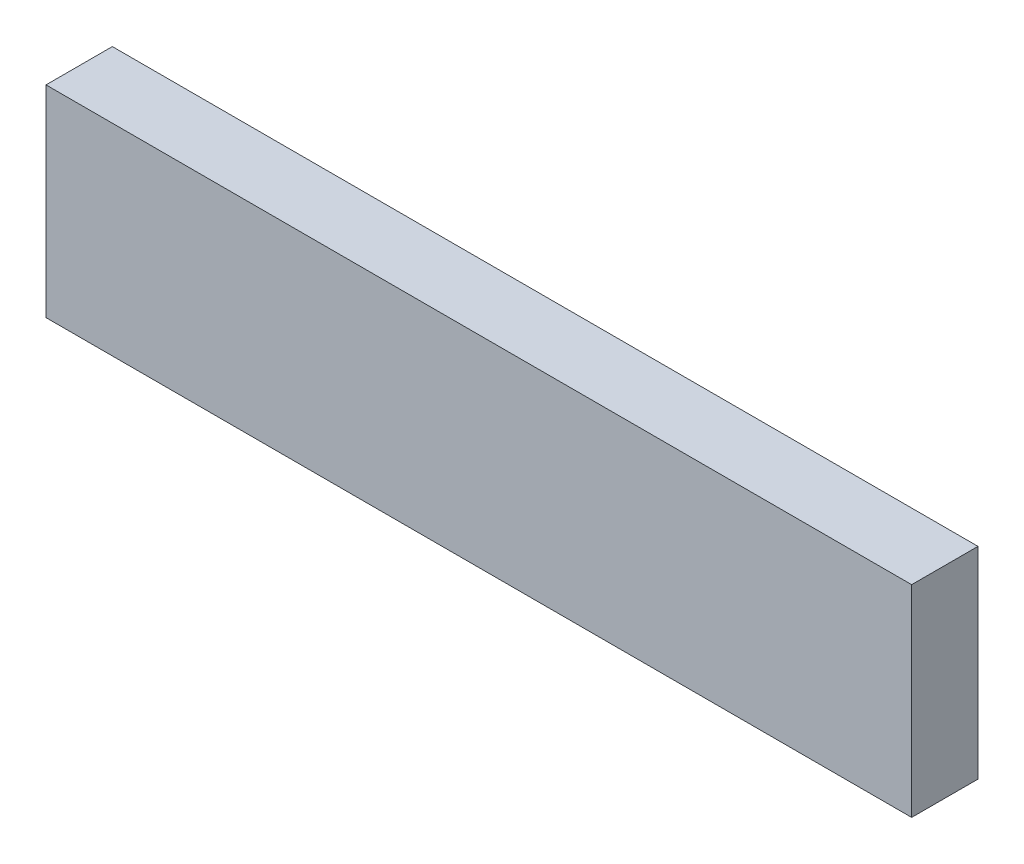
from build123d import *

# Parameters (mm, degrees)
SKETCH_1_W      = 130.473092558
SKETCH_1_H      = 30.38465224
EXTRUDE_1_DEPTH = 10


with BuildPart() as part:
    # Эскиз1 → Бобышка-Вытянуть1 (new body)
    with BuildSketch(Plane.XY):
        Rectangle(SKETCH_1_W, SKETCH_1_H)
    extrude(amount=EXTRUDE_1_DEPTH)


solid = part.part
